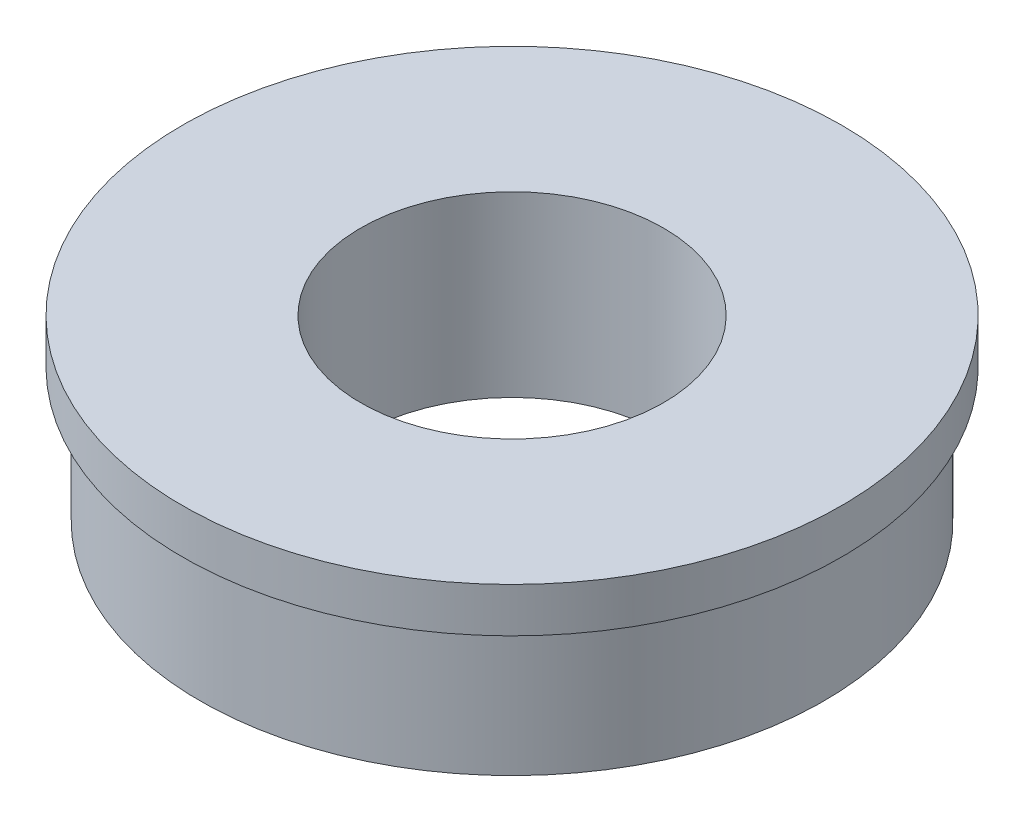
from build123d import *


with BuildPart() as part:
    # Sketch1 → Revolve1 (revolve)
    with BuildSketch(Plane.XY, mode=Mode.PRIVATE) as revolve1_sk:
        Polygon((8.5, 0), (18.5, 0), (18.5, -2.5), (17.5, -2.5), (17.5, -10), (8.5, -10), align=None)
    revolve(revolve1_sk.sketch.rotate(Axis((0, -7.378378695, 0), (0, 1, 0)), 90), axis=Axis((0, -7.378378695, 0), (0, 1, 0)))


solid = part.part
